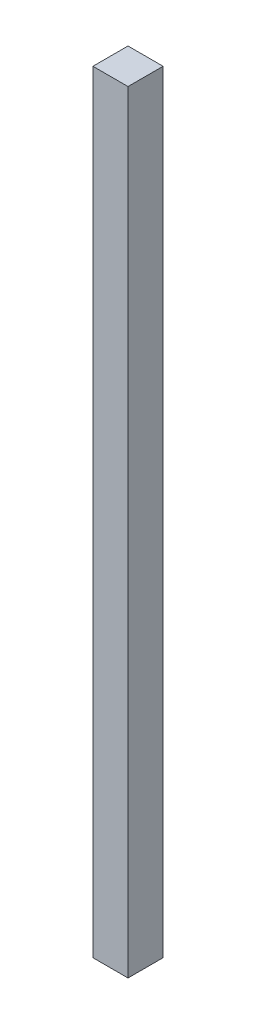
from build123d import *

# Parameters (mm, degrees)
SKETCH1_W           = 100
SKETCH1_H           = 100
BOSS_EXTRUDE1_DEPTH = 2200
SHELL1_T            = 3
CUT_EXTRUDE2_DEPTH  = 10


with BuildPart() as part:
    # Sketch1 → Boss-Extrude1 (new body)
    with BuildSketch(Plane(origin=(0, 0, 0), x_dir=(1, 0, 0), z_dir=(0, 1, 0))):
        Rectangle(SKETCH1_W, SKETCH1_H)
    extrude(amount=BOSS_EXTRUDE1_DEPTH)

    # Shell1 (no face opened: a closed hollow body)
    add(offset(amount=-SHELL1_T, mode=Mode.PRIVATE), mode=Mode.SUBTRACT)

    # Sketch3 → Cut-Extrude2 (cut)
    with BuildSketch(Plane(origin=(0, 0, -50), x_dir=(-1, 0, 0), z_dir=(0, 0, -1))):
        with BuildLine():
            Line((-25, 350), (-25, 1850))
            ThreePointArc((-25, 1850), (0, 1875), (25, 1850))
            Line((25, 1850), (25, 350))
            ThreePointArc((25, 350), (0, 325), (-25, 350))
        make_face()
    extrude(amount=-CUT_EXTRUDE2_DEPTH, mode=Mode.SUBTRACT)


solid = part.part
